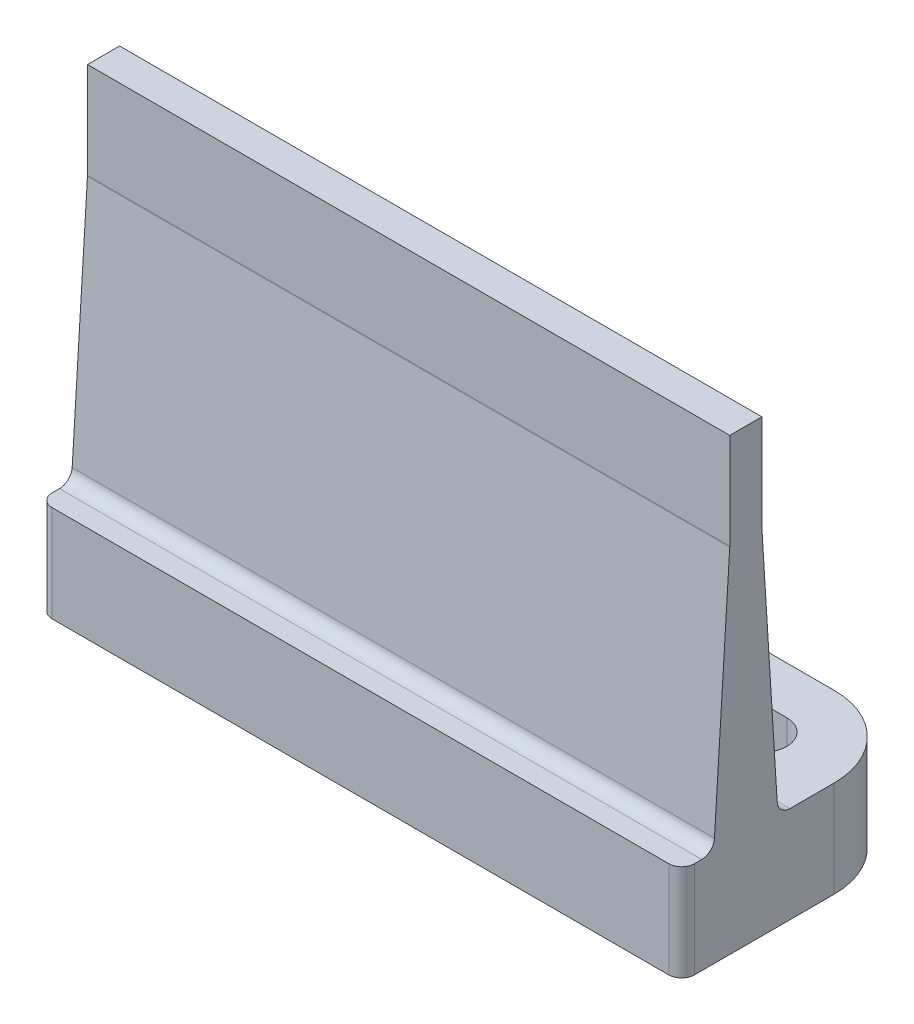
from build123d import *

# Parameters (mm, degrees)
BOSS_EXTRUDE1_DEPTH = 20
CUT_EXTRUDE1_REACH  = 33.532
FILLET1_R           = 5
FILLET2_R           = 0.79375


with BuildPart() as part:
    # Sketch1 → Boss-Extrude1 (new, symmetric)
    with BuildSketch(Plane(origin=(0, 0, 0), x_dir=(0, 0, -1), z_dir=(1, 0, 0))):
        Polygon((-4, 0), (10.5, 0), (10.5, 6), (2, 6), (1, 22), (1, 28), (-1, 28), (-1, 22), (-2, 6), (-4, 6), align=None)
    extrude(amount=BOSS_EXTRUDE1_DEPTH, both=True)

    # Sketch4 → Cut-Extrude1 (cut, up to next)
    with BuildSketch(Plane(origin=(0, 6, 0), x_dir=(1, 0, 0), z_dir=(0, 1, 0)), mode=Mode.PRIVATE) as cut_extrude1_sk1:
        with BuildLine():
            Line((-15, 7.55), (-5, 7.55))
            ThreePointArc((-5, 7.55), (-3.45, 6), (-5, 4.45))
            Line((-5, 4.45), (-15, 4.45))
            ThreePointArc((-15, 4.45), (-16.55, 6), (-15, 7.55))
        make_face()
    cut_extrude1_tool1 = extrude(cut_extrude1_sk1.sketch, amount=-CUT_EXTRUDE1_REACH, mode=Mode.PRIVATE) & part.part
    # Sketch4 → Cut-Extrude1 (cut, up to next)
    with BuildSketch(Plane(origin=(0, 6, 0), x_dir=(1, 0, 0), z_dir=(0, 1, 0)), mode=Mode.PRIVATE) as cut_extrude1_sk2:
        with BuildLine():
            Line((5, 7.55), (15, 7.55))
            ThreePointArc((15, 7.55), (16.55, 6), (15, 4.45))
            Line((15, 4.45), (5, 4.45))
            ThreePointArc((5, 4.45), (3.45, 6), (5, 7.55))
        make_face()
    cut_extrude1_tool2 = extrude(cut_extrude1_sk2.sketch, amount=-CUT_EXTRUDE1_REACH, mode=Mode.PRIVATE) & part.part
    add(cut_extrude1_tool1.solids().sort_by_distance((-10, 6, -6))[0], mode=Mode.SUBTRACT)
    add(cut_extrude1_tool2.solids().sort_by_distance((10, 6, -6))[0], mode=Mode.SUBTRACT)

    # Fillet1
    fillet1_edges = [part.edges().sort_by_distance(p)[0] for p in [
        (20, 3, -10.5),
        (-20, 3, -10.5),
    ]]
    fillet(fillet1_edges, radius=FILLET1_R)

    # Fillet2
    fillet2_edges = [part.edges().sort_by_distance(p)[0] for p in [
        (-20, 3, 4),
        (0, 6, 2),
        (0, 22, 1),
        (0, 22, -1),
        (0, 6, -2),
        (20, 3, 4),
    ]]
    fillet(fillet2_edges, radius=FILLET2_R)


solid = part.part
